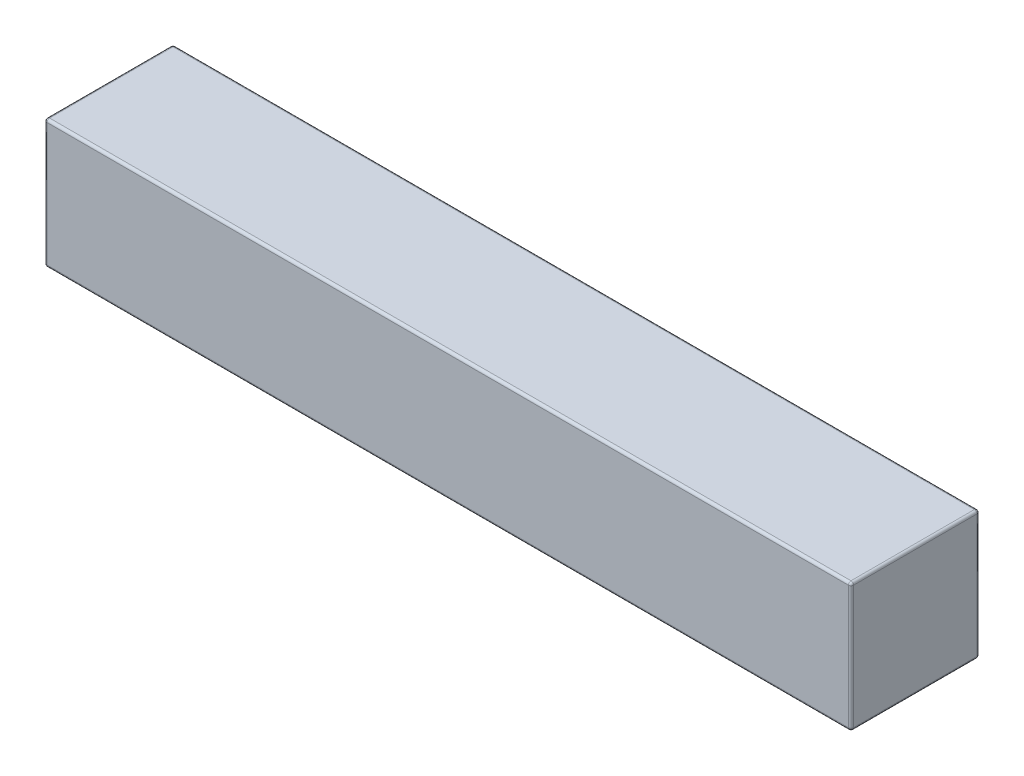
from build123d import *

# Parameters (mm, degrees)
SKETCH1_W           = 125.5
SKETCH1_H           = 20
BOSS_EXTRUDE1_DEPTH = 20
FILLET1_R           = 0.4
CUT_EXTRUDE1_DEPTH  = 0.6


with BuildPart() as part:
    # Sketch1 → Boss-Extrude1 (new body)
    with BuildSketch(Plane.XY):
        with Locations((62.75, -10)):
            Rectangle(SKETCH1_W, SKETCH1_H)
    extrude(amount=BOSS_EXTRUDE1_DEPTH)

    # Fillet1
    fillet1_edges = [part.edges().sort_by_distance(p)[0] for p in [
        (125.5, -10, 20),
        (62.75, 0, 20),
        (0, -10, 20),
        (62.75, 0, 0),
        (125.5, -10, 0),
        (62.75, -20, 0),
        (0, -10, 0),
        (0, 0, 10),
        (125.5, 0, 10),
        (125.5, -20, 10),
        (0, -20, 10),
        (62.75, -20, 20),
    ]]
    fillet(fillet1_edges, radius=FILLET1_R)

    # Sketch2 → Cut-Extrude1 (cut)
    with BuildSketch(Plane(origin=(0, 0, 0), x_dir=(-1, 0, 0), z_dir=(0, 0, -1))):
        Polygon((-74.366945263, -16.316901728), (-80.134035107, -16.316901728), (-80.134035107, -4.78272204), (-74.366945263, -3.180752639), align=None)
        with BuildLine():
            Line((-57.546266552, -14.074144566), (-57.546266552, -16.316901728))
            Line((-57.546266552, -16.316901728), (-67.878969189, -16.316901728))
            add(Edge.make_bspline(
                [(-67.878969189, -16.316901728), (-67.705972662, -16.107710863), (-67.370455977, -15.701997369), (-66.887548782, -15.10859586), (-66.43763762, -14.549527819), (-66.023644885, -14.021820882), (-65.640372658, -13.529579363), (-65.291318914, -13.071459877), (-64.978619028, -12.64512484), (-64.695729106, -12.251325979), (-64.445822511, -11.882014175), (-64.228201066, -11.532020948), (-64.049016346, -11.195376551), (-63.896188231, -10.878752474), (-63.780730828, -10.57709072), (-63.695526935, -10.293154159), (-63.646326017, -10.024196815), (-63.6378279, -9.849954737), (-63.633750276, -9.766348724)],
                knots=[0, 0, 0, 0, 1.648477186, 3.197125458, 4.646012435, 6.006316077, 7.270166078, 8.434548375, 9.503700427, 10.480865904, 11.378855857, 12.211361565, 12.982121599, 13.693810259, 14.344973607, 14.941442485, 15.492075768, 16, 16, 16, 16], degree=3))
            add(Edge.make_bspline(
                [(-63.633750276, -9.766348724), (-63.63761519, -9.678226006), (-63.645182749, -9.505680427), (-63.718477287, -9.258876389), (-63.835299629, -9.03401472), (-63.996612476, -8.837126712), (-64.18913759, -8.672378913), (-64.409501583, -8.551568757), (-64.652136972, -8.478827964), (-64.821377215, -8.471165342), (-64.907816565, -8.467251663)],
                knots=[0, 0, 0, 0, 1.040931809, 2.038159793, 3.018963058, 4.023210429, 5.032448662, 6.000486047, 6.978749463, 8, 8, 8, 8], degree=3))
            add(Edge.make_bspline(
                [(-64.907816565, -8.467251663), (-65.024529267, -8.474287394), (-65.260711798, -8.488525064), (-65.608569086, -8.597731909), (-65.949290336, -8.772233168), (-66.222122639, -8.97200242), (-66.440175186, -9.166520594), (-66.616282736, -9.333652206), (-66.795353229, -9.525249725), (-66.983192681, -9.735511466), (-67.178926331, -9.966362222), (-67.38085624, -10.218471226), (-67.588582252, -10.492069183), (-67.72742926, -10.682243763), (-67.798870719, -10.780094985)],
                knots=[0, 0, 0, 0, 1.093734572, 2.213306666, 3.389740152, 4.673908339, 5.372839767, 6.13144368, 6.951060167, 7.832681641, 8.776975261, 9.790579287, 10.863178676, 12, 12, 12, 12], degree=3))
            Line((-67.798870719, -10.780094985), (-67.638673779, -4.945422058))
            add(Edge.make_bspline(
                [(-67.638673779, -4.945422058), (-67.448366635, -4.812826952), (-67.080258926, -4.556350607), (-66.522099469, -4.225019564), (-65.986501615, -3.946166391), (-65.463517955, -3.719429652), (-64.932723712, -3.549637799), (-64.382912665, -3.425321537), (-63.803228059, -3.356109491), (-63.407814726, -3.346077037), (-63.205724077, -3.340949579)],
                knots=[0, 0, 0, 0, 1.159094463, 2.242015715, 3.241844795, 4.176118816, 5.087519341, 6.023486108, 6.989829271, 8, 8, 8, 8], degree=3))
            add(Edge.make_bspline(
                [(-63.205724077, -3.340949579), (-63.016958514, -3.345259345), (-62.646621459, -3.353714627), (-62.104066149, -3.420644673), (-61.585734161, -3.526575274), (-61.093284803, -3.680564483), (-60.624606953, -3.875600406), (-60.182524331, -4.117652558), (-59.765053358, -4.401850534), (-59.375599547, -4.726537369), (-59.018864943, -5.087565258), (-58.709944035, -5.488271101), (-58.447147473, -5.922035103), (-58.234454585, -6.39035542), (-58.068614997, -6.8914053), (-57.952832255, -7.425911988), (-57.877361687, -7.992848915), (-57.870284678, -8.382729395), (-57.866660432, -8.582393213)],
                knots=[0, 0, 0, 0, 1.074229238, 2.107518372, 3.106995267, 4.081931566, 5.039864063, 5.992033513, 6.945777082, 7.910233706, 8.874140538, 9.828888763, 10.783518848, 11.754792575, 12.750561242, 13.781894681, 14.864073997, 16, 16, 16, 16], degree=3))
            add(Edge.make_bspline(
                [(-57.866660432, -8.582393213), (-57.873643881, -8.808888166), (-57.88770629, -9.264975782), (-57.995575418, -9.948818509), (-58.165512868, -10.635407813), (-58.408984758, -11.322960433), (-58.71785052, -12.01272301), (-59.097242158, -12.703498853), (-59.541692122, -13.39796021), (-59.882545319, -13.845353678), (-60.056852973, -14.074144566)],
                knots=[0, 0, 0, 0, 0.902103076, 1.816543967, 2.751824317, 3.716988727, 4.718465792, 5.75981875, 6.854402009, 8, 8, 8, 8], degree=3))
            Line((-60.056852973, -14.074144566), (-57.546266552, -14.074144566))
        make_face()
        with BuildLine():
            Line((-41.846966422, -3.501146519), (-41.846966422, -5.743903681))
            Line((-41.846966422, -5.743903681), (-46.204823808, -5.743903681))
            Line((-46.204823808, -5.743903681), (-46.652874625, -7.506070022))
            add(Edge.make_bspline(
                [(-46.652874625, -7.506070022), (-46.482321613, -7.519978175), (-46.150491526, -7.547038052), (-45.670998184, -7.632750902), (-45.221158106, -7.73968848), (-44.803517412, -7.883642785), (-44.416099293, -8.056302553), (-44.057713612, -8.259238727), (-43.732182612, -8.495373132), (-43.436864576, -8.758952053), (-43.17785264, -9.050652292), (-42.946787881, -9.360978428), (-42.757049446, -9.697754865), (-42.597058119, -10.053798877), (-42.478880766, -10.434318217), (-42.390442896, -10.834337514), (-42.337206819, -11.255917098), (-42.330815898, -11.544215241), (-42.327557242, -11.691215082)],
                knots=[0, 0, 0, 0, 1.217686971, 2.369147101, 3.464164001, 4.50681488, 5.509294206, 6.480446105, 7.433459119, 8.367357942, 9.292867885, 10.206577389, 11.116571509, 12.039427559, 12.980684995, 13.947849621, 14.953632596, 16, 16, 16, 16], degree=3))
            add(Edge.make_bspline(
                [(-42.327557242, -11.691215082), (-42.332725578, -11.861629228), (-42.342878918, -12.196412612), (-42.412286374, -12.688172595), (-42.536879393, -13.154655851), (-42.703957245, -13.60012135), (-42.924799915, -14.01898868), (-43.18830034, -14.419192643), (-43.506136215, -14.791086867), (-43.865866195, -15.13790055), (-44.262063383, -15.453344127), (-44.692407679, -15.725153686), (-45.146600907, -15.96107806), (-45.631005561, -16.147423967), (-46.140669633, -16.296555526), (-46.678014611, -16.399103083), (-47.241820982, -16.467820433), (-47.627191764, -16.4739588), (-47.82431475, -16.477098668)],
                knots=[0, 0, 0, 0, 1.001936993, 1.968333403, 2.91189952, 3.835723145, 4.759455594, 5.690079001, 6.647318133, 7.629130035, 8.624331341, 9.619109397, 10.617364864, 11.628542224, 12.665579242, 13.7353975, 14.841621563, 16, 16, 16, 16], degree=3))
            add(Edge.make_bspline(
                [(-47.82431475, -16.477098668), (-47.995452758, -16.475053682), (-48.334038311, -16.471007808), (-48.835051603, -16.427924871), (-49.324287373, -16.367601082), (-49.801602388, -16.27697018), (-50.265692358, -16.158728213), (-50.719384223, -16.018967858), (-51.158976946, -15.851259859), (-51.58211369, -15.659515534), (-51.981403937, -15.449441543), (-52.339227629, -15.208497153), (-52.664104958, -14.957055497), (-52.944815308, -14.680999749), (-53.186215526, -14.384843017), (-53.386082097, -14.069843268), (-53.548162951, -13.734853048), (-53.621822964, -13.499525351), (-53.658987677, -13.380792185)],
                knots=[0, 0, 0, 0, 1.163667245, 2.302240872, 3.417871835, 4.515255233, 5.603932667, 6.673677212, 7.742352562, 8.801402191, 9.832207051, 10.806445689, 11.731706445, 12.622549934, 13.477799023, 14.324761977, 15.154768787, 16, 16, 16, 16], degree=3))
            Line((-53.658987677, -13.380792185), (-53.55886459, -13.273159866))
            add(Edge.make_bspline(
                [(-53.55886459, -13.273159866), (-53.330613981, -13.347625882), (-52.871949032, -13.497263826), (-52.157836047, -13.643020924), (-51.424612066, -13.737143757), (-50.928429994, -13.74817774), (-50.677822745, -13.753750686)],
                knots=[0, 0, 0, 0, 0.98115573, 1.97161245, 2.975519971, 4, 4, 4, 4], degree=3))
            add(Edge.make_bspline(
                [(-50.677822745, -13.753750686), (-50.584340925, -13.75214615), (-50.40133342, -13.749004982), (-50.132991054, -13.729209046), (-49.877825928, -13.694925577), (-49.637285272, -13.644277755), (-49.410062417, -13.582499541), (-49.197250101, -13.503969468), (-48.996145528, -13.415036947), (-48.810927669, -13.310055836), (-48.645272381, -13.193042846), (-48.496992607, -13.070667442), (-48.373408996, -12.936145926), (-48.270480154, -12.794812841), (-48.191182852, -12.644659155), (-48.136347966, -12.486783515), (-48.098864731, -12.321242642), (-48.096064227, -12.20705874), (-48.094647086, -12.149278208)],
                knots=[0, 0, 0, 0, 1.331593224, 2.606833628, 3.830465399, 4.995919138, 6.106066241, 7.181376235, 8.224006534, 9.235276467, 10.207957358, 11.110353994, 11.968214499, 12.802704758, 13.594817664, 14.376700065, 15.178560784, 16, 16, 16, 16], degree=3))
            add(Edge.make_bspline(
                [(-48.094647086, -12.149278208), (-48.096215228, -12.090702648), (-48.099265921, -11.97674867), (-48.133188948, -11.812524108), (-48.186522157, -11.659131543), (-48.260425217, -11.515786217), (-48.361386515, -11.388115386), (-48.477586534, -11.267157393), (-48.618557274, -11.160802325), (-48.78050932, -11.065991168), (-48.961738669, -10.979818408), (-49.166154048, -10.908685384), (-49.390872731, -10.845829137), (-49.637137752, -10.797305349), (-49.903398763, -10.756277325), (-50.191832798, -10.730564192), (-50.501526285, -10.711889455), (-50.715336983, -10.710648325), (-50.825504299, -10.710008824)],
                knots=[0, 0, 0, 0, 0.814446033, 1.584438367, 2.32285386, 3.071071758, 3.816851133, 4.580773861, 5.400915678, 6.265507767, 7.190421024, 8.189801626, 9.274824997, 10.436656683, 11.681899897, 13.023836303, 14.466512816, 16, 16, 16, 16], degree=3))
            add(Edge.make_bspline(
                [(-50.825504299, -10.710008824), (-50.94822196, -10.711827853), (-51.188198727, -10.715384999), (-51.53928648, -10.746172307), (-51.871525144, -10.794811586), (-52.185032293, -10.865966434), (-52.47954607, -10.954216522), (-52.754585324, -11.065898504), (-53.012007067, -11.194903344), (-53.170152468, -11.299158338), (-53.248483018, -11.350796584)],
                knots=[0, 0, 0, 0, 1.156825485, 2.262194689, 3.320222464, 4.320246568, 5.290750089, 6.21544117, 7.116095219, 8, 8, 8, 8], degree=3))
            Line((-53.248483018, -11.350796584), (-53.381146109, -11.238158111))
            Line((-53.381146109, -11.238158111), (-51.458782828, -3.501146519))
            Line((-51.458782828, -3.501146519), (-41.846966422, -3.501146519))
        make_face()
    extrude(amount=-CUT_EXTRUDE1_DEPTH, mode=Mode.SUBTRACT)


solid = part.part
